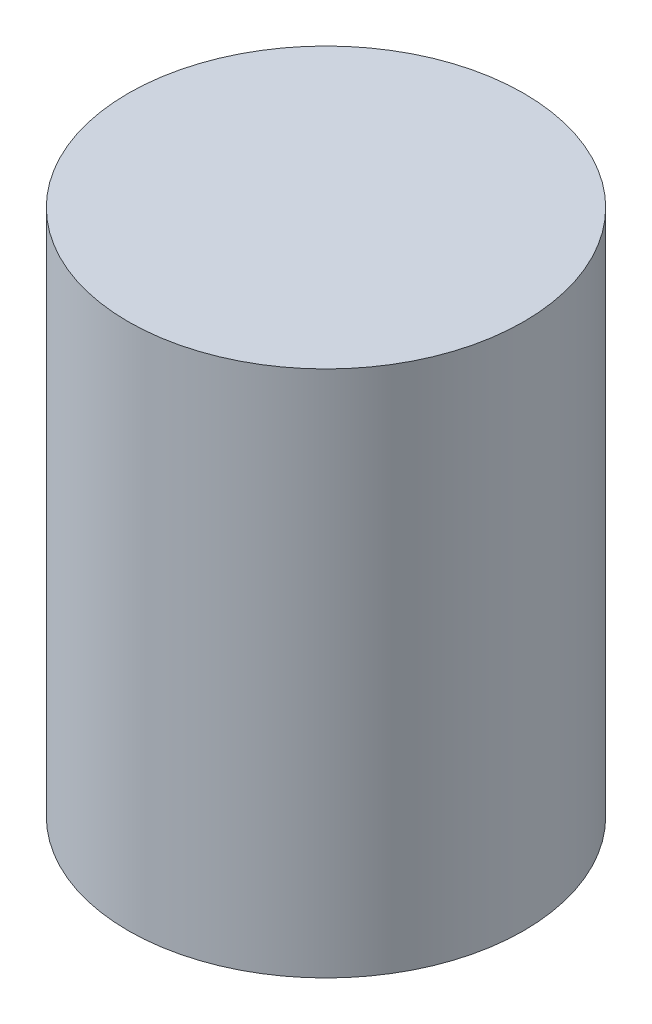
from build123d import *

# Parameters (mm, degrees)
CROQUIS1_R              = 15
SALIENTE_EXTRUIR1_DEPTH = 40


with BuildPart() as part:
    # Croquis1 → Saliente-Extruir1 (new body)
    with BuildSketch(Plane(origin=(0, 0, 0), x_dir=(1, 0, 0), z_dir=(0, 1, 0))):
        with Locations(Location((0, 0, 0), (0, 0, 270))):
            Circle(CROQUIS1_R)
    extrude(amount=SALIENTE_EXTRUIR1_DEPTH)


solid = part.part
